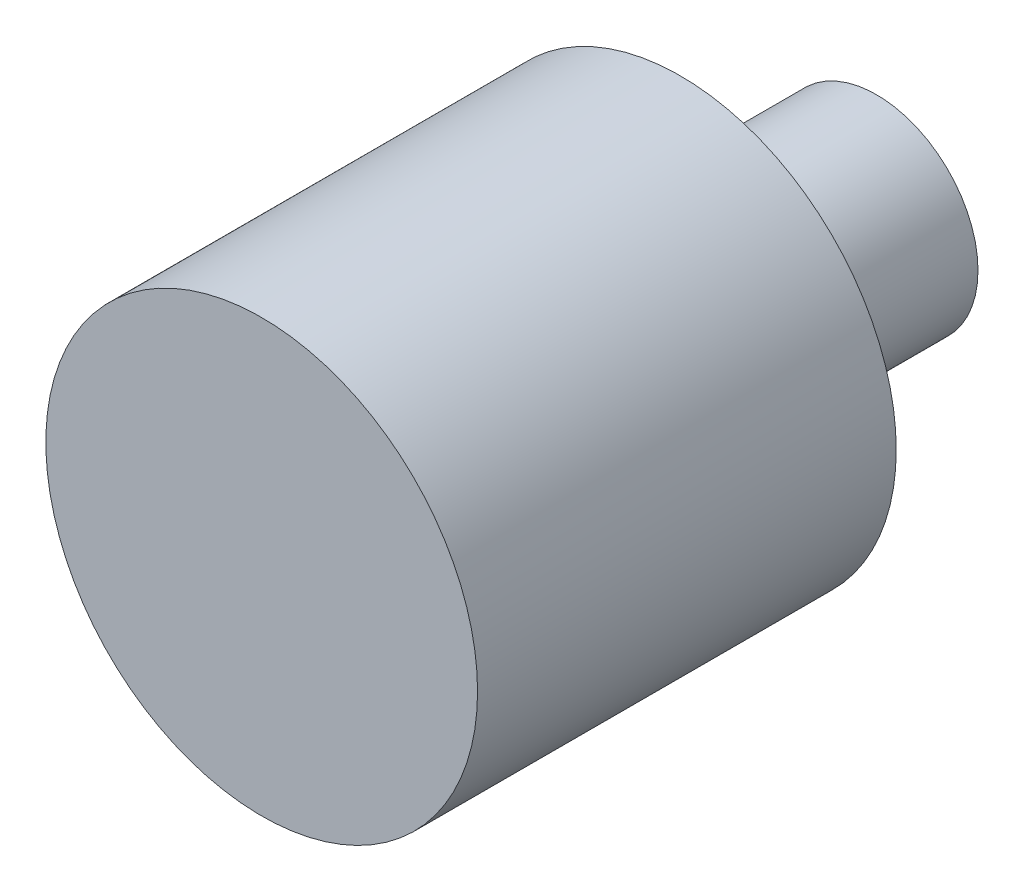
from build123d import *

# Parameters (mm, degrees)
SKETCH_1_R             = 16.5
EXTRUDE_1_DEPTH        = 32
SKETCH_2_R             = 3
EXTRUDE_2_DEPTH        = 15
HOLE_WIZARD_M3_1_D     = 2.5
HOLE_WIZARD_M3_1_DEPTH = 4
HOLE_WIZARD_M3_1_TIP   = 0.751075774
SKETCH_5_R             = 7.75
EXTRUDE_3_DEPTH        = 11


with BuildPart() as part:
    # 草图1 → 凸台-拉伸1 (new body)
    with BuildSketch(Plane.XY):
        Circle(SKETCH_1_R)
    extrude(amount=EXTRUDE_1_DEPTH)

    # 草图2 → 凸台-拉伸2 (add)
    with BuildSketch(Plane(origin=(0, 0, 0), x_dir=(-1, 0, 0), z_dir=(0, 0, -1))):
        with Locations(Location((0, 0, 0), (0, 0, 180))):
            Circle(SKETCH_2_R)
    extrude(amount=EXTRUDE_2_DEPTH)

    # M3 螺纹孔1
    with Locations(Plane(origin=(0, 0, 0), x_dir=(-1, 0, 0), z_dir=(0, 0, -1))):
        with Locations((0, 12.5), (12.5, 0), (0, -12.5), (-12.5, 0)):
            Hole(HOLE_WIZARD_M3_1_D / 2, depth=HOLE_WIZARD_M3_1_DEPTH)
            with Locations((0, 0, -(HOLE_WIZARD_M3_1_DEPTH + HOLE_WIZARD_M3_1_TIP / 2))):  # 118° drill point
                Cone(0, HOLE_WIZARD_M3_1_D / 2, HOLE_WIZARD_M3_1_TIP, mode=Mode.SUBTRACT)

    # 草图5 → 凸台-拉伸3 (add)
    with BuildSketch(Plane(origin=(0, 0, -15), x_dir=(-1, 0, 0), z_dir=(0, 0, -1))):
        Circle(SKETCH_5_R)
    extrude(amount=-EXTRUDE_3_DEPTH)


solid = part.part
